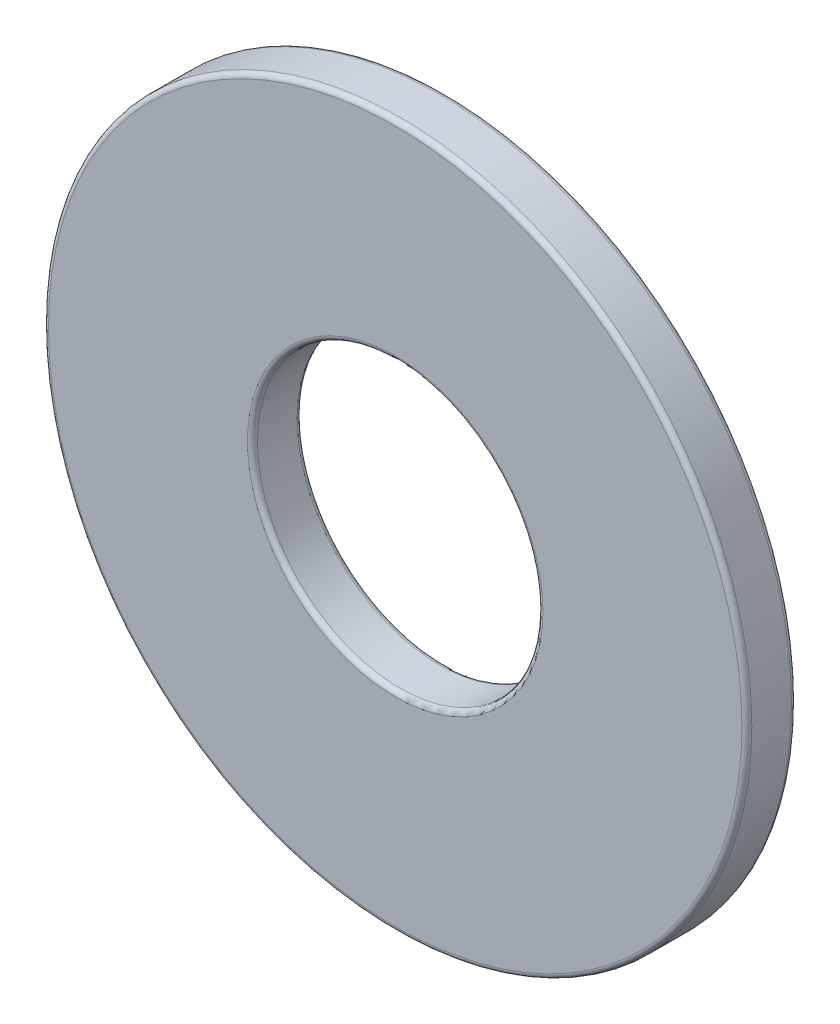
from build123d import *

# Parameters (mm, degrees)
BOSS_EXTRUDE1_DEPTH      = 1.7907
BOSS_EXTRUDE1_DEPTH_BACK = 1.7907
SKETCH3_R                = 25.4
SKETCH3_R_2              = 10.3124
FILLET1_R                = 0.35814


with BuildPart() as part:
    # Sketch3 → Boss-Extrude1 (new, two sides: drawn at the far end of the back side and taken through both)
    with BuildSketch(Plane.XY.offset(-BOSS_EXTRUDE1_DEPTH_BACK)):
        Circle(SKETCH3_R)
        Circle(SKETCH3_R_2, mode=Mode.SUBTRACT)
    extrude(amount=BOSS_EXTRUDE1_DEPTH + BOSS_EXTRUDE1_DEPTH_BACK)

    # Fillet1
    fillet1_edges = [part.edges().sort_by_distance(p)[0] for p in [
        (-25.4, 0, -1.7907),
        (-10.3124, 0, -1.7907),
        (-25.4, 0, 1.7907),
        (-10.3124, 0, 1.7907),
    ]]
    fillet(fillet1_edges, radius=FILLET1_R)


solid = part.part
